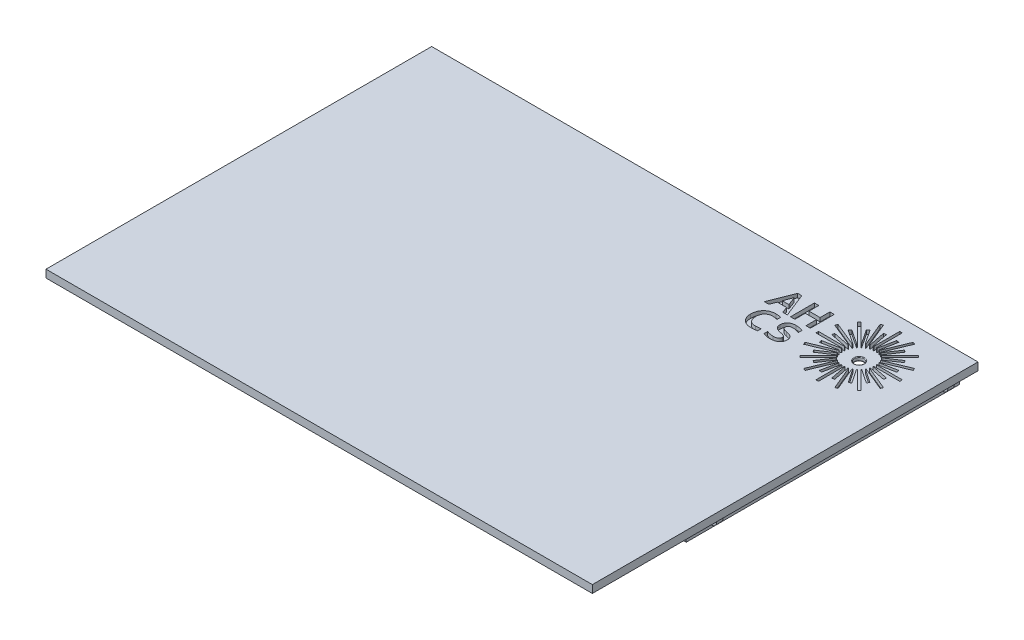
from build123d import *

# Parameters (mm, degrees)
SKETCH1_W            = 215.9
SKETCH1_H            = 114.3
BOSS_EXTRUDE1_DEPTH  = 3.048
SKETCH5_W            = 215.9
SKETCH5_H            = 3.048
BOSS_EXTRUDE3_DEPTH  = 38.1
SKETCH6_R            = 6.35
CUT_EXTRUDE1_DEPTH   = 1.524
SKETCH7_W            = 1.01595327
SKETCH7_H            = 20.456452526
CUT_EXTRUDE2_DEPTH   = 1.524
CIRPATTERN1_COUNT    = 16
CUT_EXTRUDE4_DEPTH   = 1.524
CIRPATTERN2_COUNT    = 16
CUT_EXTRUDE5_DEPTH   = 1.524
SKETCH10_W           = 3.556
SKETCH10_H           = 104.14
BOSS_EXTRUDE4_DEPTH  = 5.08
BOSS_EXTRUDE5_DEPTH  = 2.54
SKETCH12_W           = 3.556
SKETCH12_H           = 5.08
BOSS_EXTRUDE6_DEPTH  = 3.81
LPATTERN1_COUNT      = 2
LPATTERN1_PITCH      = 91.44
MIRROR1_COPY_1_DEPTH = 2.54
SKETCH16_W           = 2.794
SKETCH16_H           = 5.08
BOSS_EXTRUDE7_DEPTH  = 203.2
SKETCH17_W           = 2.794
SKETCH17_H           = 5.08
BOSS_EXTRUDE8_DEPTH  = 203.2
SKETCH19_R           = 1.9
CUT_EXTRUDE6_DEPTH   = 203.2
FILLET1_R            = 0.254
FILLET2_R            = 0.254


with BuildPart() as part:
    # Sketch1 → Boss-Extrude1 (new body)
    with BuildSketch(Plane(origin=(0, 0, 0), x_dir=(1, 0, 0), z_dir=(0, 1, 0))):
        Rectangle(SKETCH1_W, SKETCH1_H)
    extrude(amount=BOSS_EXTRUDE1_DEPTH)

    # Sketch5 → Boss-Extrude3 (add)
    with BuildSketch(Plane(origin=(0, 0, -57.15), x_dir=(-1, 0, 0), z_dir=(0, 0, -1))):
        with Locations((0, 1.524)):
            Rectangle(SKETCH5_W, SKETCH5_H)
    extrude(amount=BOSS_EXTRUDE3_DEPTH)

    # Sketch6 → Cut-Extrude1 (cut)
    with BuildSketch(Plane(origin=(0, 3.048, 0), x_dir=(1, 0, 0), z_dir=(0, 1, 0))):
        with Locations(Location((82.55, 73.66, 0), (0, 0, 270))):
            Circle(SKETCH6_R)
    extrude(amount=-CUT_EXTRUDE1_DEPTH, mode=Mode.SUBTRACT)

    # Sketch7 → Cut-Extrude2 (cut)
    with BuildSketch(Plane(origin=(0, 3.048, 0), x_dir=(1, 0, 0), z_dir=(0, 1, 0))):
        with Locations((82.55, 80.01)):
            Rectangle(SKETCH7_W, SKETCH7_H)
    cut_extrude2 = extrude(amount=-CUT_EXTRUDE2_DEPTH, mode=Mode.SUBTRACT)

    # CirPattern1: Cut-Extrude2 ×16 about axis
    cirpattern1_axis = Axis((82.55, 0, -73.66), (0, 1, 0))
    for i in range(1, CIRPATTERN1_COUNT):
        add(cut_extrude2.rotate(cirpattern1_axis, i * 360 / CIRPATTERN1_COUNT), mode=Mode.SUBTRACT)

    # Sketch8 → Cut-Extrude4 (cut)
    with BuildSketch(Plane(origin=(0, 3.048, 0), x_dir=(1, 0, 0), z_dir=(0, 1, 0))):
        Polygon((79.500448666, 60.998804474), (84.577811701, 86.524432175), (85.599551334, 86.321195526), (80.522188299, 60.795567825), align=None)
    cut_extrude4 = extrude(amount=-CUT_EXTRUDE4_DEPTH, mode=Mode.SUBTRACT)

    # CirPattern2: Cut-Extrude4 ×16 about axis
    cirpattern2_axis = Axis((82.55, 0, -73.66), (0, 1, 0))
    for i in range(1, CIRPATTERN2_COUNT):
        add(cut_extrude4.rotate(cirpattern2_axis, i * 360 / CIRPATTERN2_COUNT), mode=Mode.SUBTRACT)

    # Sketch9 → Cut-Extrude5 (cut)
    # profile 1 of 4: a face of its own
    with BuildSketch(Plane(origin=(0, 3.048, 0), x_dir=(1, 0, 0), z_dir=(0, 1, 0))):
        Polygon((51.496033968, 76.054351067), (47.817213317, 76.054351067), (46.929723816, 73.66), (45.09862721, 73.66), (48.852271331, 83.104384766), (50.446426946, 83.104384766), (54.202149497, 73.66), (52.383523469, 73.66), align=None)
        with BuildLine():
            add(Edge.make_bspline(
                [(49.590113891, 80.843053202), (49.544943887, 80.721862403), (49.456444285, 80.484418596), (49.328918907, 80.135181436), (49.202459884, 79.803104187), (49.087081521, 79.484217812), (48.97546044, 79.18122663), (48.865693145, 78.89485532), (48.767601271, 78.622138664), (48.701446043, 78.446546868), (48.669369513, 78.361408085)],
                knots=[0, 0, 0, 0, 1.172678974, 2.297578372, 3.370997112, 4.39445296, 5.372303269, 6.298679512, 7.175084723, 8, 8, 8, 8], degree=3))
            Line((48.669369513, 78.361408085), (48.357605051, 77.517565608))
            Line((48.357605051, 77.517565608), (50.955642234, 77.517565608))
            Line((50.955642234, 77.517565608), (50.643877772, 78.357251226))
            add(Edge.make_bspline(
                [(50.643877772, 78.357251226), (50.612020561, 78.44316412), (50.546248133, 78.620539965), (50.444800873, 78.893397041), (50.338345542, 79.181693856), (50.226699928, 79.484670434), (50.107090156, 79.802685249), (49.986068985, 80.136775784), (49.856027825, 80.484824386), (49.768117814, 80.721793679), (49.723133394, 80.843053202)],
                knots=[0, 0, 0, 0, 0.829583545, 1.712759004, 2.635583661, 3.611999971, 4.636127821, 5.71167343, 6.829040738, 8, 8, 8, 8], degree=3))
            Line((49.723133394, 80.843053202), (49.590113891, 80.843053202))
        make_face(mode=Mode.SUBTRACT)
    # profile 2 of 4: a face of its own
    with BuildSketch(Plane(origin=(0, 3.048, 0), x_dir=(1, 0, 0), z_dir=(0, 1, 0))):
        Polygon((57.172225604, 79.246819157), (61.561869227, 79.246819157), (61.561869227, 83.104384766), (63.291122776, 83.104384766), (63.291122776, 73.66), (61.561869227, 73.66), (61.561869227, 77.783604616), (57.172225604, 77.783604616), (57.172225604, 73.66), (55.442972055, 73.66), (55.442972055, 83.104384766), (57.172225604, 83.104384766), align=None)
    # profile 3 of 4: a face of its own
    with BuildSketch(Plane(origin=(0, 3.048, 0), x_dir=(1, 0, 0), z_dir=(0, 1, 0))):
        with BuildLine():
            add(Edge.make_bspline(
                [(51.68440229, 70.344189728), (51.569928418, 70.341557274), (51.344285388, 70.336368362), (51.012769177, 70.290394015), (50.693154068, 70.221944626), (50.390445001, 70.118754214), (50.103692612, 69.992270137), (49.836512523, 69.838838031), (49.592393119, 69.655966012), (49.367749076, 69.449855589), (49.168386643, 69.214597448), (48.988272174, 68.956706441), (48.834391032, 68.670987149), (48.70310392, 68.361018579), (48.599720902, 68.02604659), (48.525286395, 67.667741799), (48.478393527, 67.286679028), (48.473605807, 67.024385396), (48.471149902, 66.88983949)],
                knots=[0, 0, 0, 0, 1.0311898, 2.032610485, 3.011249611, 3.972848753, 4.909243392, 5.832429518, 6.742815144, 7.653029452, 8.57410157, 9.516348602, 10.483103376, 11.493207285, 12.545856977, 13.636989185, 14.787872092, 16, 16, 16, 16], degree=3))
            add(Edge.make_bspline(
                [(48.471149902, 66.88983949), (48.474175567, 66.756731896), (48.480051656, 66.498225975), (48.518732834, 66.122558165), (48.587204138, 65.772009538), (48.682335236, 65.446929018), (48.803546659, 65.146802533), (48.948914311, 64.87268985), (49.11589744, 64.621955401), (49.307933158, 64.398754369), (49.524104553, 64.200949547), (49.764187417, 64.03182841), (50.024010561, 63.88319988), (50.308383403, 63.766776645), (50.611908645, 63.671669227), (50.937062225, 63.610143953), (51.279954854, 63.565536035), (51.515892522, 63.562002696), (51.636598405, 63.560195037)],
                knots=[0, 0, 0, 0, 1.221355031, 2.371972145, 3.460356745, 4.49426383, 5.475241926, 6.425055258, 7.336592403, 8.233650564, 9.120104613, 10.017973287, 10.92317089, 11.860586024, 12.831793425, 13.836642003, 14.893224465, 16, 16, 16, 16], degree=3))
            add(Edge.make_bspline(
                [(51.636598405, 63.560195037), (51.816148428, 63.563495844), (52.17869174, 63.570160757), (52.72087306, 63.621325937), (53.25118122, 63.702401316), (53.59427005, 63.785776372), (53.760753606, 63.826234045)],
                knots=[0, 0, 0, 0, 1.003734523, 2.026717865, 3.042466559, 4, 4, 4, 4], degree=3))
            Line((53.760753606, 63.826234045), (53.760753606, 62.39003909))
            add(Edge.make_bspline(
                [(53.760753606, 62.39003909), (53.59154052, 62.346736598), (53.241840615, 62.257246609), (52.694185281, 62.16751969), (52.117392586, 62.106565425), (51.724057362, 62.100208084), (51.524363199, 62.096980496)],
                knots=[0, 0, 0, 0, 0.926191764, 1.91409057, 2.940995081, 4, 4, 4, 4], degree=3))
            add(Edge.make_bspline(
                [(51.524363199, 62.096980496), (51.331565017, 62.100530271), (50.956603992, 62.107434004), (50.412145043, 62.173515699), (49.902633097, 62.278178466), (49.428766185, 62.425106174), (48.991398249, 62.614614677), (48.586219691, 62.835933241), (48.216591202, 63.095906088), (47.879916495, 63.386893478), (47.580943097, 63.713448202), (47.320919052, 64.071170838), (47.100647274, 64.460503289), (46.920337763, 64.877893942), (46.781595947, 65.322708537), (46.682369548, 65.790274343), (46.620750617, 66.279913215), (46.612880608, 66.613918843), (46.60887685, 66.783839573)],
                knots=[0, 0, 0, 0, 1.203896936, 2.341383232, 3.420178077, 4.449513245, 5.434315283, 6.393137568, 7.328425671, 8.251782613, 9.167644552, 10.087831718, 11.008436049, 11.956305619, 12.92264827, 13.914075026, 14.938814599, 16, 16, 16, 16], degree=3))
            add(Edge.make_bspline(
                [(46.60887685, 66.783839573), (46.612553279, 66.959330763), (46.619801067, 67.305297753), (46.686629489, 67.813629336), (46.791754186, 68.302984901), (46.941013071, 68.771031547), (47.133321636, 69.213227696), (47.358208937, 69.629977591), (47.627781195, 70.011426955), (47.928970538, 70.365190819), (48.269514708, 70.68395533), (48.644957126, 70.967552225), (49.056139721, 71.21455991), (49.50128666, 71.423184693), (49.978003699, 71.59658859), (50.488320648, 71.714023276), (51.027331715, 71.79179752), (51.39729529, 71.802119454), (51.586716092, 71.807404269)],
                knots=[0, 0, 0, 0, 1.059894444, 2.089497999, 3.092025576, 4.080932083, 5.052173973, 6.00197103, 6.93680796, 7.868951195, 8.804771686, 9.749147683, 10.706826702, 11.69739744, 12.715603198, 13.76545606, 14.855916819, 16, 16, 16, 16], degree=3))
            add(Edge.make_bspline(
                [(51.586716092, 71.807404269), (51.780189538, 71.804437901), (52.157740105, 71.798649229), (52.620613836, 71.74547889), (52.97198634, 71.687456331), (53.219100838, 71.634447704), (53.454601211, 71.578788469), (53.604463932, 71.529897233), (53.677616416, 71.506031956)],
                knots=[0, 0, 0, 0, 1.64119676, 3.202686367, 3.947906341, 4.662823888, 5.347284284, 6, 6, 6, 6], degree=3))
            Line((53.677616416, 71.506031956), (53.677616416, 70.078150721))
            add(Edge.make_bspline(
                [(53.677616416, 70.078150721), (53.497348505, 70.122407967), (53.152082741, 70.207173535), (52.642425099, 70.287204862), (52.157891034, 70.336016817), (51.841090445, 70.341485127), (51.68440229, 70.344189728)],
                knots=[0, 0, 0, 0, 1.104261353, 2.114983396, 3.067679218, 4, 4, 4, 4], degree=3))
        make_face()
    # profile 4 of 4: a face of its own
    with BuildSketch(Plane(origin=(0, 3.048, 0), x_dir=(1, 0, 0), z_dir=(0, 1, 0))):
        with BuildLine():
            add(Edge.make_bspline(
                [(60.881869601, 64.958978256), (60.880249117, 65.015978215), (60.877135225, 65.125508237), (60.843161965, 65.280580689), (60.789229761, 65.418861193), (60.711951438, 65.539299185), (60.617652565, 65.646222152), (60.505200286, 65.739313304), (60.380185072, 65.825977718), (60.186716494, 65.925395614), (59.917940106, 66.032147132), (59.565556747, 66.127353789), (59.188564501, 66.212242177), (58.929593306, 66.267275157), (58.797204566, 66.295408583)],
                knots=[0, 0, 0, 0, 0.755978527, 1.452673755, 2.09689063, 2.71726906, 3.343151202, 3.982949482, 4.651674898, 5.359703168, 6.866864041, 8.48353965, 10.202349296, 12, 12, 12, 12], degree=3))
            add(Edge.make_bspline(
                [(58.797204566, 66.295408583), (58.62153135, 66.337517182), (58.275545055, 66.420449563), (57.853113093, 66.545209604), (57.531943576, 66.662734376), (57.309084368, 66.770454429), (57.098414467, 66.889655933), (56.903602263, 67.027604411), (56.726189005, 67.183899905), (56.566917419, 67.358933575), (56.429452806, 67.555436805), (56.306341689, 67.769852948), (56.210577811, 68.011825691), (56.142968092, 68.280038961), (56.100992509, 68.575521539), (56.095849253, 68.781755061), (56.093167467, 68.889288906)],
                knots=[0, 0, 0, 0, 1.827938019, 3.600102038, 4.454317396, 5.285344974, 6.101903229, 6.901428973, 7.696175865, 8.49036593, 9.289891675, 10.118638932, 10.987007528, 11.913754153, 12.912194119, 14, 14, 14, 14], degree=3))
            add(Edge.make_bspline(
                [(56.093167467, 68.889288906), (56.096001089, 69.009342048), (56.101500534, 69.24233918), (56.154240952, 69.579397491), (56.241618184, 69.891989101), (56.36266109, 70.179884926), (56.513397646, 70.443985958), (56.691415843, 70.683255258), (56.891153649, 70.901860999), (57.118519169, 71.093179513), (57.364402209, 71.262812316), (57.629476489, 71.409046375), (57.909796971, 71.534679467), (58.209164655, 71.633126278), (58.524254147, 71.713169228), (58.857287235, 71.768117161), (59.207320157, 71.802244369), (59.446285936, 71.805660163), (59.568302002, 71.807404269)],
                knots=[0, 0, 0, 0, 1.125410231, 2.184177361, 3.190157998, 4.162910717, 5.105950661, 6.035232738, 6.954968474, 7.876905414, 8.816019047, 9.752678829, 10.712693857, 11.692906361, 12.704746723, 13.759177533, 14.855834742, 16, 16, 16, 16], degree=3))
            add(Edge.make_bspline(
                [(59.568302002, 71.807404269), (59.693765523, 71.806178324), (59.945036595, 71.803723072), (60.321489593, 71.772088213), (60.698904481, 71.727276353), (61.072640863, 71.663287233), (61.434059061, 71.584156588), (61.775904458, 71.499518169), (62.089711435, 71.397366848), (62.287247209, 71.319235339), (62.382495878, 71.281561544)],
                knots=[0, 0, 0, 0, 1.045391394, 2.093649323, 3.146477474, 4.212523534, 5.252206253, 6.229741471, 7.14640895, 8, 8, 8, 8], degree=3))
            Line((62.382495878, 71.281561544), (62.382495878, 69.812111713))
            add(Edge.make_bspline(
                [(62.382495878, 69.812111713), (62.26235722, 69.856941801), (62.02661387, 69.944910113), (61.671759685, 70.054550002), (61.325120003, 70.146472777), (60.985778795, 70.219029383), (60.656385025, 70.275177031), (60.336044193, 70.315408746), (60.025901099, 70.338509894), (59.821905145, 70.342323854), (59.722105803, 70.344189728)],
                knots=[0, 0, 0, 0, 1.127992761, 2.213415711, 3.266099545, 4.282309052, 5.265364249, 6.205135852, 7.121912678, 8, 8, 8, 8], degree=3))
            add(Edge.make_bspline(
                [(59.722105803, 70.344189728), (59.653496312, 70.343570067), (59.520266352, 70.342366773), (59.325850736, 70.327940567), (59.144459334, 70.302032318), (58.973506077, 70.272875059), (58.816370567, 70.228073175), (58.66965677, 70.177251368), (58.536550301, 70.114222673), (58.414541814, 70.043926406), (58.306558486, 69.962817503), (58.211381646, 69.87293871), (58.131570512, 69.772143786), (58.067244046, 69.661313546), (58.016282843, 69.541312032), (57.982447616, 69.411681775), (57.957471375, 69.273363313), (57.95613092, 69.177620597), (57.955440519, 69.128308327)],
                knots=[0, 0, 0, 0, 1.35581666, 2.632804814, 3.848880535, 4.976815591, 6.056427337, 7.074182485, 8.041988645, 8.96253653, 9.852537589, 10.704767898, 11.543024452, 12.383737606, 13.230561077, 14.110818852, 15.02697756, 16, 16, 16, 16], degree=3))
            add(Edge.make_bspline(
                [(57.955440519, 69.128308327), (57.956496907, 69.071335421), (57.958535025, 68.961416019), (57.989155918, 68.805180867), (58.033451112, 68.663560985), (58.099772718, 68.538684907), (58.182048076, 68.428230919), (58.276811127, 68.327838131), (58.383077893, 68.235154967), (58.547798181, 68.126231109), (58.782827629, 68.013822602), (59.094522542, 67.909340367), (59.435175279, 67.82917523), (59.670098026, 67.777061584), (59.790693985, 67.750309405)],
                knots=[0, 0, 0, 0, 0.809909187, 1.562580176, 2.25826993, 2.915769774, 3.564927642, 4.214010546, 4.878504091, 5.568011062, 7.01953866, 8.57317628, 10.240863861, 12, 12, 12, 12], degree=3))
            add(Edge.make_bspline(
                [(59.790693985, 67.750309405), (59.981656322, 67.707042216), (60.356786606, 67.622047272), (60.814317426, 67.491686037), (61.164553406, 67.374509238), (61.408251333, 67.266526404), (61.637286969, 67.142375537), (61.851955831, 67.004520032), (62.048571229, 66.845871737), (62.226003834, 66.666255693), (62.376764075, 66.460265256), (62.510148525, 66.233968132), (62.618724463, 65.978545274), (62.690396715, 65.689628482), (62.73753906, 65.369283029), (62.741876378, 65.144839538), (62.744142654, 65.027566438)],
                knots=[0, 0, 0, 0, 1.841677842, 3.617829276, 4.473202829, 5.313622503, 6.121415498, 6.922237347, 7.710064662, 8.493566788, 9.290000684, 10.104887641, 10.960683189, 11.890188075, 12.897610339, 14, 14, 14, 14], degree=3))
            add(Edge.make_bspline(
                [(62.744142654, 65.027566438), (62.740479282, 64.906143965), (62.733344519, 64.669662229), (62.680136991, 64.32700728), (62.585634794, 64.010225331), (62.456146619, 63.718966851), (62.292375964, 63.452129682), (62.095808192, 63.210640785), (61.868773908, 62.991529344), (61.610472747, 62.799786256), (61.325348641, 62.630476512), (61.015458044, 62.485356992), (60.679589753, 62.365043741), (60.321701886, 62.266321832), (59.942484604, 62.189401625), (59.545900619, 62.137045218), (59.132462279, 62.101971535), (58.851319265, 62.098667023), (58.707832087, 62.096980496)],
                knots=[0, 0, 0, 0, 1.034135809, 2.01407717, 2.943940946, 3.842159674, 4.72172796, 5.60285894, 6.487697637, 7.402437598, 8.336617437, 9.308152797, 10.312526245, 11.37206371, 12.468116415, 13.605707749, 14.778023214, 16, 16, 16, 16], degree=3))
            add(Edge.make_bspline(
                [(58.707832087, 62.096980496), (58.580984322, 62.098202918), (58.327639477, 62.100644382), (57.949765622, 62.132025013), (57.57443812, 62.177020071), (57.206406201, 62.240021415), (56.856163593, 62.322186), (56.531313679, 62.417084489), (56.237109244, 62.527424232), (56.057129032, 62.618497712), (55.970540112, 62.662313387)],
                knots=[0, 0, 0, 0, 1.079220034, 2.155456453, 3.224628282, 4.295716686, 5.331143514, 6.284414305, 7.174627521, 8, 8, 8, 8], degree=3))
            Line((55.970540112, 62.662313387), (55.970540112, 64.092273052))
            add(Edge.make_bspline(
                [(55.970540112, 64.092273052), (56.085220928, 64.048428639), (56.311645048, 63.961862871), (56.65171121, 63.849377211), (56.988234128, 63.757305451), (57.322067605, 63.684630849), (57.656983577, 63.627695957), (57.995549324, 63.58856938), (58.338933072, 63.565473237), (58.569235575, 63.561960361), (58.68496936, 63.560195037)],
                knots=[0, 0, 0, 0, 1.058442803, 2.089773933, 3.086715587, 4.065016448, 5.034230613, 6.014444265, 7.002199807, 8, 8, 8, 8], degree=3))
            add(Edge.make_bspline(
                [(58.68496936, 63.560195037), (58.819471914, 63.56374028), (59.087240478, 63.570798172), (59.418644525, 63.609089549), (59.674368984, 63.661508414), (59.856565091, 63.711341535), (60.028767777, 63.772778349), (60.189719221, 63.848671957), (60.34007787, 63.93400142), (60.473512925, 64.03757348), (60.593646827, 64.151900246), (60.69662397, 64.282127306), (60.780995454, 64.427624868), (60.838944491, 64.591092016), (60.874996257, 64.769652186), (60.879523866, 64.894365049), (60.881869601, 64.958978256)],
                knots=[0, 0, 0, 0, 1.929772639, 3.841804003, 4.77547276, 5.672449154, 6.549604109, 7.394405062, 8.222853292, 9.023962831, 9.811203871, 10.596623391, 11.397917866, 12.212235412, 13.073766721, 14, 14, 14, 14], degree=3))
        make_face()
    extrude(amount=-CUT_EXTRUDE5_DEPTH, mode=Mode.SUBTRACT)

    # Sketch10 → Boss-Extrude4 (add)
    with BuildSketch(Plane.XZ):
        with Locations((102.108, -36.068)):
            Rectangle(SKETCH10_W, SKETCH10_H)
    boss_extrude4 = extrude(amount=BOSS_EXTRUDE4_DEPTH)

    # Sketch11 → Boss-Extrude5 (add)
    with BuildSketch(Plane(origin=(0, 0, -88.138), x_dir=(-1, 0, 0), z_dir=(0, 0, -1))):
        with BuildLine():
            Line((-103.886, -0.762), (-103.886, -4.318))
            ThreePointArc((-103.886, -4.318), (-105.664, -2.54), (-103.886, -0.762))
        make_face()
    boss_extrude5 = extrude(amount=-BOSS_EXTRUDE5_DEPTH)

    # Sketch12 → Boss-Extrude6 (add)
    with BuildSketch(Plane(origin=(0, 0, -88.138), x_dir=(-1, 0, 0), z_dir=(0, 0, -1))):
        with Locations((-102.108, -2.54)):
            Rectangle(SKETCH12_W, SKETCH12_H)
    boss_extrude6 = extrude(amount=BOSS_EXTRUDE6_DEPTH)

    # LPattern1: Boss-Extrude5 ×2
    with Locations(*[(0, 0, i * LPATTERN1_PITCH) for i in range(1, LPATTERN1_COUNT)]):
        add(boss_extrude5)

    # Mirror1: Boss-Extrude4, Boss-Extrude5, Boss-Extrude6 across plane
    add(boss_extrude4.mirror(Plane(origin=(0, 0, 0), x_dir=(0, 0, 1), z_dir=(1, 0, 0))))
    add(boss_extrude5.mirror(Plane(origin=(0, 0, 0), x_dir=(0, 0, 1), z_dir=(1, 0, 0))))
    add(boss_extrude6.mirror(Plane(origin=(0, 0, 0), x_dir=(0, 0, 1), z_dir=(1, 0, 0))))

    # Mirror1 copy 1 sketch → Mirror1 copy 1 (add)
    with BuildSketch(Plane(origin=(0, 0, 3.302), x_dir=(1, 0, 0), z_dir=(0, 0, -1))):
        with BuildLine():
            Line((-103.886, 0.762), (-103.886, 4.318))
            ThreePointArc((-103.886, 4.318), (-105.664, 2.54), (-103.886, 0.762))
        make_face()
    extrude(amount=-MIRROR1_COPY_1_DEPTH)

    # Sketch16 → Boss-Extrude7 (add)
    with BuildSketch(Plane.ZY.offset(-100.33)):
        with Locations((-90.551, -2.54)):
            Rectangle(SKETCH16_W, SKETCH16_H)
    extrude(amount=BOSS_EXTRUDE7_DEPTH)

    # Sketch17 → Boss-Extrude8 (add)
    with BuildSketch(Plane.ZY.offset(-100.33)):
        with Locations((14.605, -2.54)):
            Rectangle(SKETCH17_W, SKETCH17_H)
    extrude(amount=BOSS_EXTRUDE8_DEPTH)

    # Sketch19 → Cut-Extrude6 (cut)
    with BuildSketch(Plane(origin=(0, 3.048, 0), x_dir=(1, 0, 0), z_dir=(0, 1, 0))):
        with Locations(Location((82.55, 73.66, 0), (0, 0, 270))):
            Circle(SKETCH19_R)
    extrude(amount=-CUT_EXTRUDE6_DEPTH, mode=Mode.SUBTRACT)

    # Fillet1
    fillet1_edges = [part.edges().sort_by_distance(p)[0] for p in [
        (82.55, 1.524, -75.56),
    ]]
    fillet(fillet1_edges, radius=FILLET1_R)

    # Fillet2
    fillet2_edges = [part.edges().sort_by_distance(p)[0] for p in [
        (82.55, 0, -75.56),
    ]]
    fillet(fillet2_edges, radius=FILLET2_R)


solid = part.part
